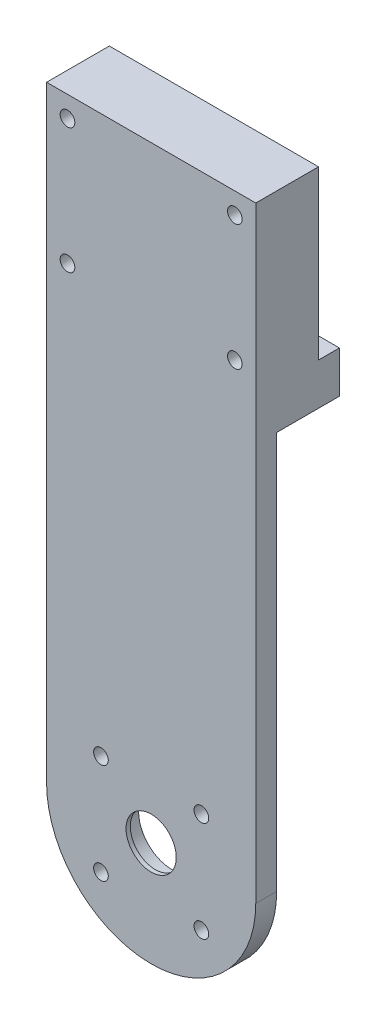
from build123d import *

# Parameters (mm, degrees)
BOSS_EXTRUDE1_DEPTH = 5
SKETCH3_R           = 6
CUT_EXTRUDE2_DEPTH  = 36.707142143
SKETCH4_R           = 8
CUT_EXTRUDE3_DEPTH  = 4
SKETCH5_W           = 50
SKETCH5_H           = 120
BOSS_EXTRUDE2_DEPTH = 5
SKETCH6_R           = 1.75
CUT_EXTRUDE4_DEPTH  = 148.224318643
CUT_EXTRUDE5_DEPTH  = 2
SKETCH9_W           = 50
SKETCH9_H           = 40
BOSS_EXTRUDE3_DEPTH = 10
SKETCH10_W          = 50
SKETCH10_H          = 10
BOSS_EXTRUDE4_DEPTH = 15
SKETCH11_R          = 1.75
CUT_EXTRUDE6_DEPTH  = 148.901994577


with BuildPart() as part:
    # Sketch1 → Boss-Extrude1 (new body)
    with BuildSketch(Plane.XY):
        with BuildLine():
            Line((-25, 0), (-25, 25))
            Line((-25, 25), (25, 25))
            Line((25, 25), (25, 0))
            ThreePointArc((25, 0), (0, -25), (-25, 0))
        make_face()
    extrude(amount=BOSS_EXTRUDE1_DEPTH)

    # Sketch3 → Cut-Extrude2 (cut, through all)
    with BuildSketch(Plane(origin=(0, 0, 0), x_dir=(-1, 0, 0), z_dir=(0, 0, -1))):
        Circle(SKETCH3_R)
    extrude(amount=-CUT_EXTRUDE2_DEPTH, mode=Mode.SUBTRACT)

    # Sketch4 → Cut-Extrude3 (cut)
    with BuildSketch(Plane(origin=(0, 0, 0), x_dir=(-1, 0, 0), z_dir=(0, 0, -1))):
        Circle(SKETCH4_R)
    extrude(amount=-CUT_EXTRUDE3_DEPTH, mode=Mode.SUBTRACT)

    # Sketch5 → Boss-Extrude2 (add)
    with BuildSketch(Plane.XY):
        with Locations((0, 85)):
            Rectangle(SKETCH5_W, SKETCH5_H)
    extrude(amount=BOSS_EXTRUDE2_DEPTH)

    # Sketch6 → Cut-Extrude4 (cut, through all)
    with BuildSketch(Plane(origin=(0, 0, 0), x_dir=(-1, 0, 0), z_dir=(0, 0, -1))):
        with Locations((-12, -12)):
            Circle(SKETCH6_R)
        with Locations(Location((12, -12, 0), (0, 0, 180))):
            Circle(SKETCH6_R)
        with Locations((12, 12)):
            Circle(SKETCH6_R)
        with Locations(Location((-12, 12, 0), (0, 0, 180))):
            Circle(SKETCH6_R)
    extrude(amount=-CUT_EXTRUDE4_DEPTH, mode=Mode.SUBTRACT)

    # Sketch7 → Cut-Extrude5 (cut)
    with BuildSketch(Plane(origin=(0, 0, 0), x_dir=(-1, 0, 0), z_dir=(0, 0, -1))):
        Polygon((-8.709103466, -12), (-10.354551733, -9.15), (-13.645448267, -9.15), (-15.290896534, -12), (-13.645448267, -14.85), (-10.354551733, -14.85), align=None)
        Polygon((10.354551733, -14.85), (8.709103466, -12), (10.354551733, -9.15), (13.645448267, -9.15), (15.290896534, -12), (13.645448267, -14.85), align=None)
        Polygon((8.709103466, 12), (10.354551733, 9.15), (13.645448267, 9.15), (15.290896534, 12), (13.645448267, 14.85), (10.354551733, 14.85), align=None)
        Polygon((-10.354551733, 14.85), (-8.709103466, 12), (-10.354551733, 9.15), (-13.645448267, 9.15), (-15.290896534, 12), (-13.645448267, 14.85), align=None)
    extrude(amount=-CUT_EXTRUDE5_DEPTH, mode=Mode.SUBTRACT)

    # Sketch9 → Boss-Extrude3 (add)
    with BuildSketch(Plane(origin=(0, 0, 0), x_dir=(-1, 0, 0), z_dir=(0, 0, -1))):
        with Locations((0, 125)):
            Rectangle(SKETCH9_W, SKETCH9_H)
    extrude(amount=BOSS_EXTRUDE3_DEPTH)

    # Sketch10 → Boss-Extrude4 (add)
    with BuildSketch(Plane(origin=(0, 0, 0), x_dir=(-1, 0, 0), z_dir=(0, 0, -1))):
        with Locations((0, 100)):
            Rectangle(SKETCH10_W, SKETCH10_H)
    extrude(amount=BOSS_EXTRUDE4_DEPTH)

    # Sketch11 → Cut-Extrude6 (cut, through all)
    with BuildSketch(Plane(origin=(0, 0, -10), x_dir=(-1, 0, 0), z_dir=(0, 0, -1))):
        with Locations((-20, 140)):
            Circle(SKETCH11_R)
        with Locations(Location((20, 140, 0), (0, 0, 180))):
            Circle(SKETCH11_R)
        with Locations((20, 110)):
            Circle(SKETCH11_R)
        with Locations(Location((-20, 110, 0), (0, 0, 180))):
            Circle(SKETCH11_R)
    extrude(amount=-CUT_EXTRUDE6_DEPTH, mode=Mode.SUBTRACT)


solid = part.part
